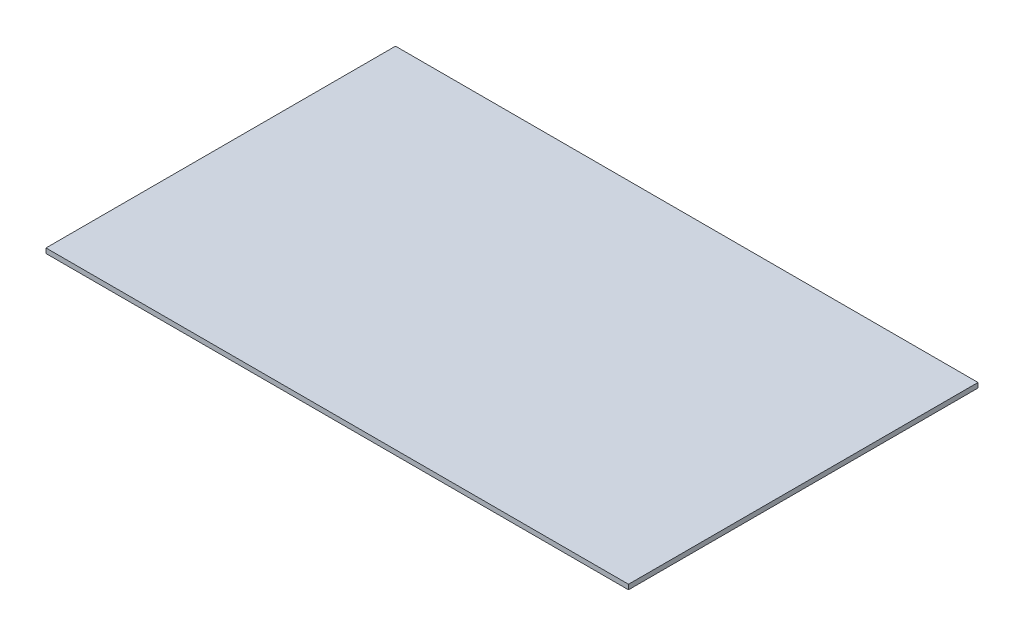
from build123d import *

# Parameters (mm, degrees)
SKETCH1_W           = 3048
SKETCH1_H           = 1828.8
BOSS_EXTRUDE1_DEPTH = 25.4


with BuildPart() as part:
    # Sketch1 → Boss-Extrude1 (new body)
    with BuildSketch(Plane(origin=(0, 0, 0), x_dir=(1, 0, 0), z_dir=(0, 1, 0))):
        Rectangle(SKETCH1_W, SKETCH1_H)
    extrude(amount=BOSS_EXTRUDE1_DEPTH)


solid = part.part
